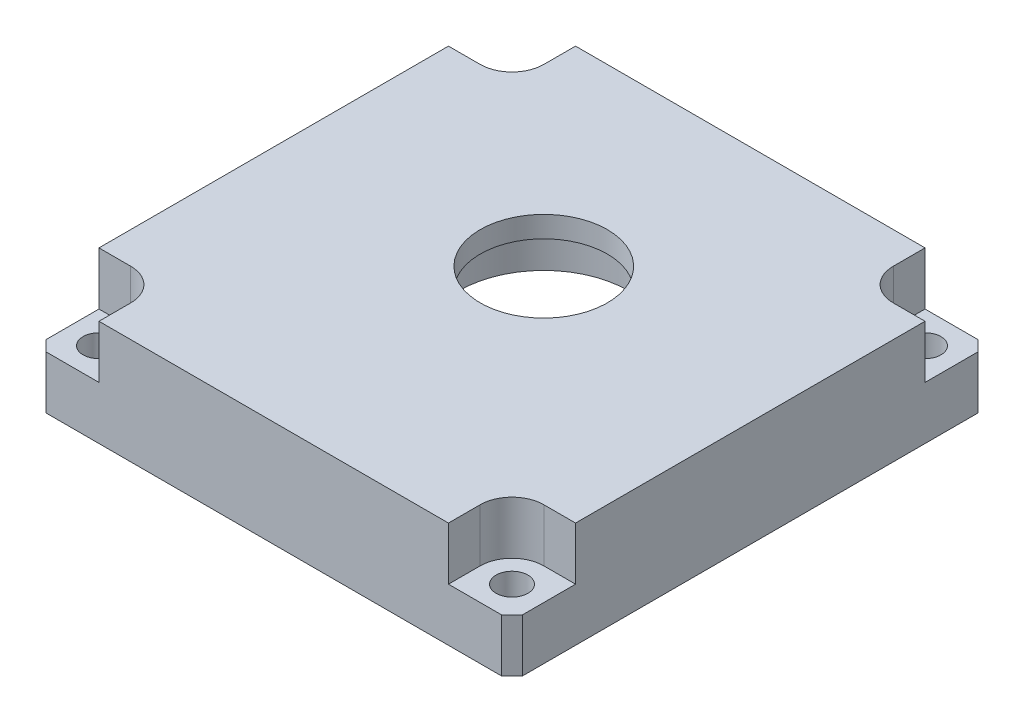
from build123d import *

# Parameters (mm, degrees)
SKETCH_1_W          = 45
SKETCH_1_H          = 45
EXTRUDE_1_DEPTH     = 10
SKETCH_2_R          = 4
CUT_EXTRUDE_4_DEPTH = 34.35416016
SKETCH_3_R          = 15
CUT_EXTRUDE_5_DEPTH = 4
SKETCH_4_R          = 8
CUT_EXTRUDE_6_DEPTH = 4
SKETCH_5_R          = 1.5
CUT_EXTRUDE_7_DEPTH = 34.35416016
CUT_EXTRUDE_8_DEPTH = 5
CHAMFER_1_SIZE      = 1
SKETCH_7_R          = 6
CUT_EXTRUDE_9_DEPTH = 33.810059433


with BuildPart() as part:
    # 草图1 → 凸台-拉伸1 (new body)
    with BuildSketch(Plane(origin=(0, 0, 0), x_dir=(1, 0, 0), z_dir=(0, 1, 0))):
        Rectangle(SKETCH_1_W, SKETCH_1_H)
    extrude(amount=EXTRUDE_1_DEPTH)

    # 草图2 → 切除-拉伸4 (cut, through all)
    with BuildSketch(Plane(origin=(0, 0, 0), x_dir=(1, 0, 0), z_dir=(0, 1, 0))):
        with Locations(Location((0, 3, 0), (0, 0, 270))):
            Circle(SKETCH_2_R)
    extrude(amount=CUT_EXTRUDE_4_DEPTH, mode=Mode.SUBTRACT)

    # 草图3 → 切除-拉伸5 (cut)
    with BuildSketch(Plane.XZ):
        with Locations(Location((0, -3, 0), (0, 0, 270))):
            Circle(SKETCH_3_R)
    extrude(amount=-CUT_EXTRUDE_5_DEPTH, mode=Mode.SUBTRACT)

    # 草图4 → 切除-拉伸6 (cut)
    with BuildSketch(Plane.XZ.offset(-4)):
        with Locations(Location((0, -3, 0), (0, 0, 270))):
            Circle(SKETCH_4_R)
    extrude(amount=-CUT_EXTRUDE_6_DEPTH, mode=Mode.SUBTRACT)

    # 草图5 → 切除-拉伸7 (cut, through all)
    with BuildSketch(Plane(origin=(0, 10, 0), x_dir=(1, 0, 0), z_dir=(0, 1, 0))):
        with Locations(Location((-19.5, 19.5, 0), (0, 0, 270))):
            Circle(SKETCH_5_R)
        with Locations(Location((19.5, 19.5, 0), (0, 0, 90))):
            Circle(SKETCH_5_R)
        with Locations(Location((19.5, -19.5, 0), (0, 0, 270))):
            Circle(SKETCH_5_R)
        with Locations(Location((-19.5, -19.5, 0), (0, 0, 90))):
            Circle(SKETCH_5_R)
    extrude(amount=-CUT_EXTRUDE_7_DEPTH, mode=Mode.SUBTRACT)

    # 草图6 → 切除-拉伸8 (cut)
    with BuildSketch(Plane(origin=(0, 10, 0), x_dir=(1, 0, 0), z_dir=(0, 1, 0))):
        with BuildLine():
            Line((-16.5, 22.5), (-16.5, 19.5))
            ThreePointArc((-16.5, 19.5), (-17.378679656, 17.378679656), (-19.5, 16.5))
            Line((-19.5, 16.5), (-22.5, 16.5))
            Line((-22.5, 16.5), (-22.5, 22.5))
            Line((-22.5, 22.5), (-16.5, 22.5))
        make_face()
        with BuildLine():
            Line((22.5, 16.5), (22.5, 22.5))
            Line((22.5, 22.5), (16.5, 22.5))
            Line((16.5, 22.5), (16.5, 19.5))
            ThreePointArc((16.5, 19.5), (17.378679656, 17.378679656), (19.5, 16.5))
            Line((19.5, 16.5), (22.5, 16.5))
        make_face()
        with BuildLine():
            Line((19.5, -16.5), (22.5, -16.5))
            Line((22.5, -16.5), (22.5, -22.5))
            Line((22.5, -22.5), (16.5, -22.5))
            Line((16.5, -22.5), (16.5, -19.5))
            ThreePointArc((16.5, -19.5), (17.378679656, -17.378679656), (19.5, -16.5))
        make_face()
        with BuildLine():
            Line((-22.5, -16.5), (-22.5, -22.5))
            Line((-22.5, -22.5), (-16.5, -22.5))
            Line((-16.5, -22.5), (-16.5, -19.5))
            ThreePointArc((-16.5, -19.5), (-17.378679656, -17.378679656), (-19.5, -16.5))
            Line((-19.5, -16.5), (-22.5, -16.5))
        make_face()
    extrude(amount=-CUT_EXTRUDE_8_DEPTH, mode=Mode.SUBTRACT)

    # 倒角1
    chamfer_1_edges = [part.edges().sort_by_distance(p)[0] for p in [
        (22.5, 2.5, 22.5),
        (-22.5, 2.5, 22.5),
        (-22.5, 2.5, -22.5),
        (22.5, 2.5, -22.5),
    ]]
    chamfer(chamfer_1_edges, length=CHAMFER_1_SIZE)

    # 草图7 → 切除-拉伸9 (cut, through all)
    with BuildSketch(Plane.XZ.offset(-8)):
        with Locations(Location((0, -3, 0), (0, 0, 270))):
            Circle(SKETCH_7_R)
    extrude(amount=-CUT_EXTRUDE_9_DEPTH, mode=Mode.SUBTRACT)


solid = part.part
